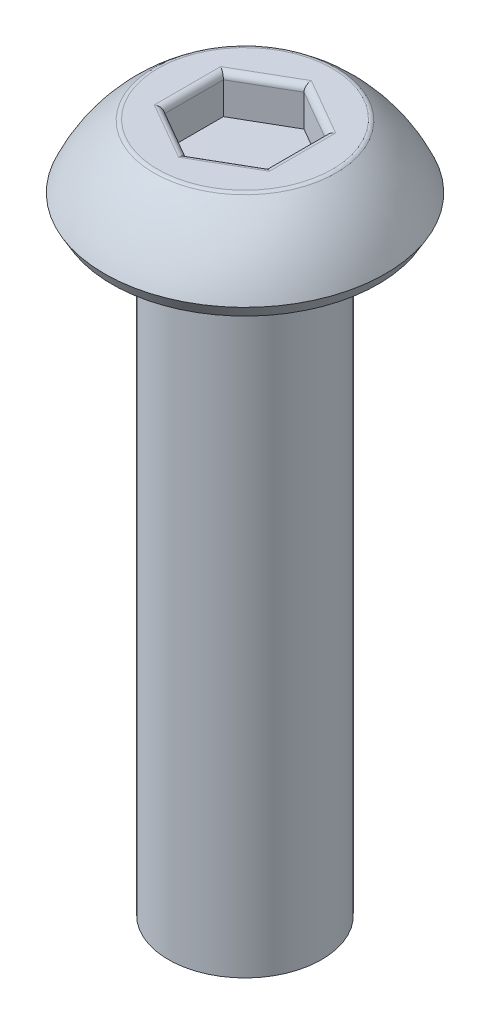
from build123d import *

# Parameters (mm, degrees)
CUT_EXTRUDE1_DEPTH = 0.75
FILLET1_R          = 0.125


with BuildPart() as part:
    # Sketch1 → Revolve1 (revolve)
    with BuildSketch(Plane(origin=(0, 0, 0), x_dir=(0, 0, -1), z_dir=(1, 0, 0)), mode=Mode.PRIVATE) as revolve1_sk:
        with BuildLine():
            Line((0, 1.5), (-1.75, 1.5))
            ThreePointArc((-1.75, 1.5), (-2.334912942, 0.942930354), (-2.75, 0.25))
            Line((-2.75, 0.25), (-2.605662433, 0))
            Line((-2.605662433, 0), (-1.5, 0))
            Line((-1.5, 0), (-1.5, -12))
            Line((-1.5, -12), (0, -12))
            Line((0, -12), (0, 1.5))
        make_face()
    revolve(revolve1_sk.sketch.rotate(Axis((0, -12, 0), (0, 1, 0)), 180), axis=Axis((0, -12, 0), (0, 1, 0)))

    # Sketch2 → Cut-Extrude1 (cut)
    with BuildSketch(Plane(origin=(0, 1.5, 0), x_dir=(1, 0, 0), z_dir=(0, 1, 0))):
        Polygon((0, 1.154700538), (-1, 0.577350269), (-1, -0.577350269), (0, -1.154700538), (1, -0.577350269), (1, 0.577350269), align=None)
    extrude(amount=-CUT_EXTRUDE1_DEPTH, mode=Mode.SUBTRACT)

    # Fillet1
    fillet1_edges = [part.edges().sort_by_distance(p)[0] for p in [
        (0.5, 1.5, -0.866025404),
        (-0.5, 1.5, -0.866025404),
        (-1, 1.5, 0),
        (-0.5, 1.5, 0.866025404),
        (0.5, 1.5, 0.866025404),
        (1, 1.5, 0),
        (0, 1.5, 1.75),
    ]]
    fillet(fillet1_edges, radius=FILLET1_R)


solid = part.part
